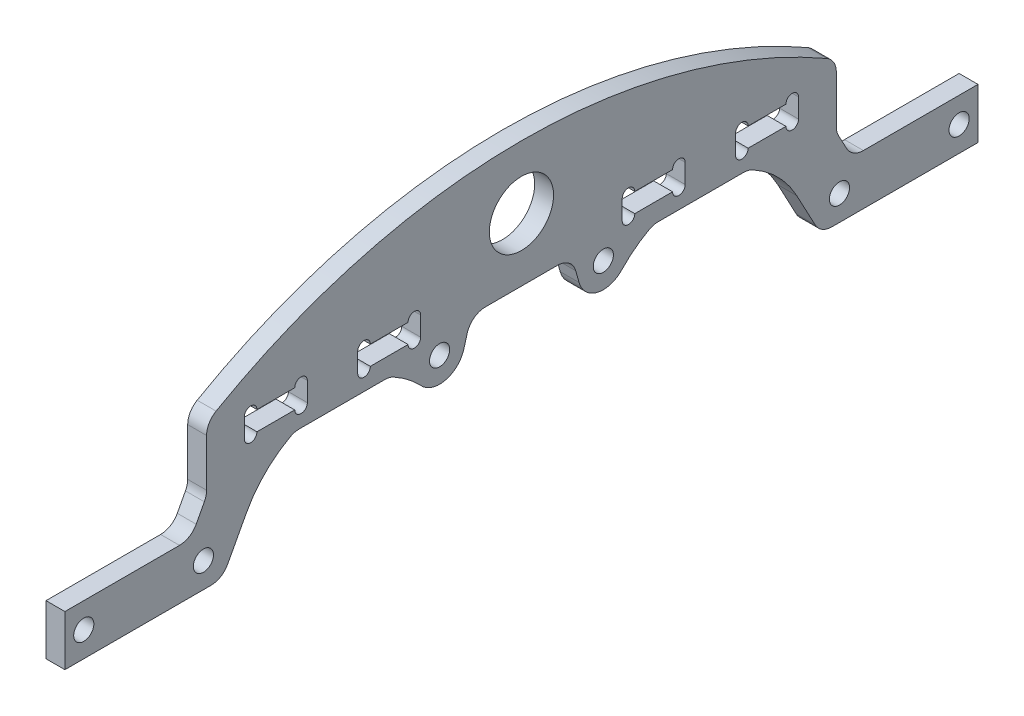
from build123d import *

# Parameters (mm, degrees)
SKETCH_2_R          = 1.6
SKETCH_2_R_2        = 10
SKETCH_2_R_3        = 5.1
SKETCH_2_R_4        = 4
EXTRUDE_1_DEPTH     = 3
SKETCH_3_R          = 1
SKETCH_3_W          = 10
SKETCH_3_H          = 3.05
CUT_EXTRUDE_1_DEPTH = 80.507861247
FILLET_1_R          = 3


with BuildPart() as part:
    # 草图2 → 凸台-拉伸1 (new body)
    # profile 1 of 5: a face of its own
    with BuildSketch(Plane(origin=(0, 0, 0), x_dir=(0, 0, -1), z_dir=(1, 0, 0))):
        with BuildLine():
            Line((-72.5, -4), (-47.5, -4))
            Line((-47.5, -4), (-43.710028433, 3.096407942))
            ThreePointArc((-43.710028433, 3.096407942), (-40.443183901, 7.410718134), (-36, 10.5))
            Line((-36, 10.5), (-21, 10.5))
            ThreePointArc((-21, 10.5), (-18.287060326, 8.866629069), (-15.918567159, 6.764681785))
            ThreePointArc((-15.918567159, 6.764681785), (-14.470668447, 13.219829878), (-9, 9.5))
            ThreePointArc((-9, 9.5), (-9.03759069, 8.952905441), (-9.149656228, 8.416093713))
            Line((-9.149656228, 8.416093713), (-8, 12.5))
            Line((-8, 12.5), (0, 12.5))
            ThreePointArc((0, 12.5), (-10, 22.500000014), (2.8e-08, 32.5))
            ThreePointArc((2.8e-08, 32.5), (-25.937249131, 28.981693295), (-50, 18.681042995))
            Line((-50, 18.681042995), (-50, 8.681042995))
            Line((-50, 8.681042995), (-52.5, 4))
            Line((-52.5, 4), (-72.5, 4))
            Line((-72.5, 4), (-72.5, -4))
        make_face()
        with Locations((-69.5, 0)):
            Circle(SKETCH_2_R, mode=Mode.SUBTRACT)
        with Locations((-50.5, 0)):
            Circle(SKETCH_2_R, mode=Mode.SUBTRACT)
    # profile 2 of 5: a face of its own
    with BuildSketch(Plane(origin=(0, 0, 0), x_dir=(0, 0, -1), z_dir=(1, 0, 0))):
        with BuildLine():
            ThreePointArc((50, 18.681042995), (25.937249158, 28.981693288), (2.8e-08, 32.5))
            ThreePointArc((2.8e-08, 32.5), (7.071067822, 29.571067802), (10, 22.5))
            ThreePointArc((10, 22.5), (7.071067812, 15.428932188), (0, 12.5))
            Line((0, 12.5), (8, 12.5))
            Line((8, 12.5), (9.149656228, 8.416093713))
            ThreePointArc((9.149656228, 8.416093713), (12.452905441, 13.46240931), (17, 9.5))
            ThreePointArc((17, 9.5), (16.719829878, 8.029331553), (15.918567159, 6.764681785))
            ThreePointArc((15.918567159, 6.764681785), (18.287060326, 8.866629069), (21, 10.5))
            Line((21, 10.5), (36, 10.5))
            ThreePointArc((36, 10.5), (40.443183901, 7.410718134), (43.710028433, 3.096407942))
            Line((43.710028433, 3.096407942), (47.5, -4))
            Line((47.5, -4), (72.5, -4))
            Line((72.5, -4), (72.5, 4))
            Line((72.5, 4), (52.5, 4))
            Line((52.5, 4), (50, 8.681042995))
            Line((50, 8.681042995), (50, 18.681042995))
        make_face()
        with Locations((50.5, 0)):
            Circle(SKETCH_2_R, mode=Mode.SUBTRACT)
        with Locations((69.5, 0)):
            Circle(SKETCH_2_R, mode=Mode.SUBTRACT)
    # profile 3 of 5: a face of its own
    with BuildSketch(Plane(origin=(0, 0, 0), x_dir=(0, 0, -1), z_dir=(1, 0, 0))):
        with Locations((0, 22.5)):
            Circle(SKETCH_2_R_2)
        with Locations((0, 22.5)):
            Circle(SKETCH_2_R_3, mode=Mode.SUBTRACT)
    # profile 4 of 5: a face of its own
    with BuildSketch(Plane(origin=(0, 0, 0), x_dir=(0, 0, -1), z_dir=(1, 0, 0))):
        with Locations((-13, 9.5)):
            Circle(SKETCH_2_R_4)
        with Locations((-13, 9.5)):
            Circle(SKETCH_2_R, mode=Mode.SUBTRACT)
    # profile 5 of 5: a face of its own
    with BuildSketch(Plane(origin=(0, 0, 0), x_dir=(0, 0, -1), z_dir=(1, 0, 0))):
        with Locations((13, 9.5)):
            Circle(SKETCH_2_R_4)
        with Locations((13, 9.5)):
            Circle(SKETCH_2_R, mode=Mode.SUBTRACT)
    extrude(amount=EXTRUDE_1_DEPTH)

    # 草图3 → 切除-拉伸1 (cut, through all)
    with BuildSketch(Plane(origin=(3, 0, 0), x_dir=(0, 0, -1), z_dir=(1, 0, 0))):
        with Locations((-43, 16.525)):
            Circle(SKETCH_3_R)
        with Locations((-43, 13.475)):
            Circle(SKETCH_3_R)
        with Locations((-35, 16.525)):
            Circle(SKETCH_3_R)
        with Locations((-35, 13.475)):
            Circle(SKETCH_3_R)
        with Locations((-25, 16.525)):
            Circle(SKETCH_3_R)
        with Locations((-17, 16.525)):
            Circle(SKETCH_3_R)
        with Locations((-17, 13.475)):
            Circle(SKETCH_3_R)
        with Locations((-25, 13.475)):
            Circle(SKETCH_3_R)
        with Locations((25, 13.475)):
            Circle(SKETCH_3_R)
        with Locations((17, 13.475)):
            Circle(SKETCH_3_R)
        with Locations((17, 16.525)):
            Circle(SKETCH_3_R)
        with Locations((25, 16.525)):
            Circle(SKETCH_3_R)
        with Locations((35, 13.475)):
            Circle(SKETCH_3_R)
        with Locations((35, 16.525)):
            Circle(SKETCH_3_R)
        with Locations((43, 13.475)):
            Circle(SKETCH_3_R)
        with Locations((43, 16.525)):
            Circle(SKETCH_3_R)
        with Locations((-21, 15)):
            Rectangle(SKETCH_3_W, SKETCH_3_H)
        with Locations((-39, 15)):
            Rectangle(SKETCH_3_W, SKETCH_3_H)
        with Locations((21, 15)):
            Rectangle(SKETCH_3_W, SKETCH_3_H)
        with Locations((39, 15)):
            Rectangle(SKETCH_3_W, SKETCH_3_H)
    extrude(amount=-CUT_EXTRUDE_1_DEPTH, mode=Mode.SUBTRACT)

    # 圆角1
    fillet_1_edges = [part.edges().sort_by_distance(p)[0] for p in [
        (1.5, 10.5, 36),
        (1.5, -4, 47.5),
        (1.5, 4, 52.5),
        (1.5, 8.681042995, 50),
        (1.5, 18.681042995, 50),
        (1.5, 18.681042995, -50),
        (1.5, 8.681042995, -50),
        (1.5, 4, -52.5),
        (1.5, -4, -47.5),
        (1.5, 10.5, -36),
        (1.5, 10.5, -21),
        (1.5, 12.5, -8),
        (1.5, 12.5, 8),
        (1.5, 10.5, 21),
    ]]
    fillet(fillet_1_edges, radius=FILLET_1_R)


solid = part.part
